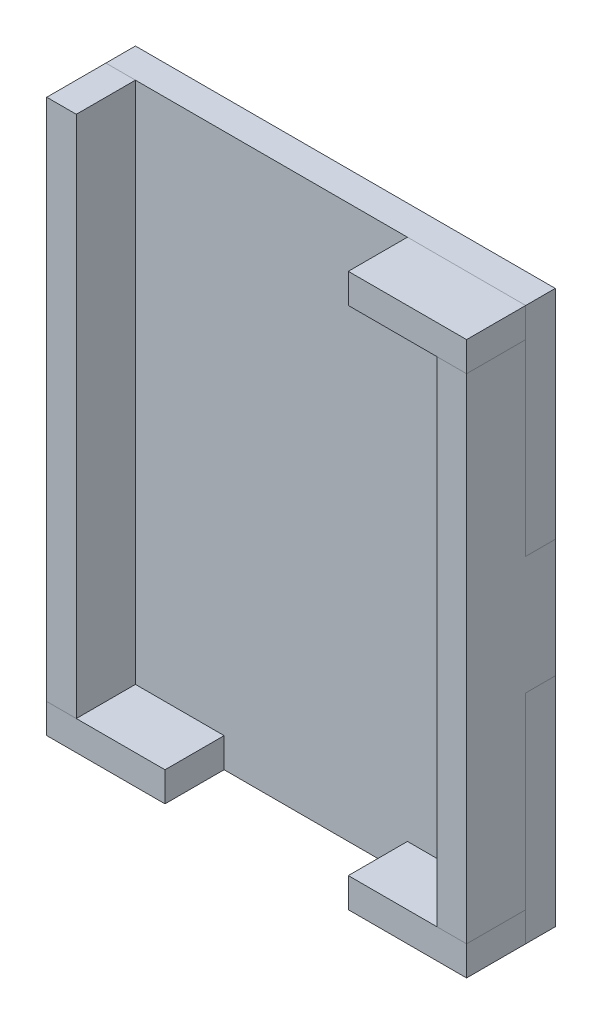
from build123d import *

# Parameters (mm, degrees)
BOSS_EXTRU_1_DEPTH   = 3.175
ESQUISSE2_W          = 25.4
ESQUISSE2_H          = 6.35
BOSS_EXTRU_2_DEPTH   = 12.7
ESQUISSE3_W          = 25.4
ESQUISSE3_H          = 6.35
BOSS_EXTRU_3_DEPTH   = 12.7
BOSS_EXTRU_3_2_DEPTH = 12.7
BOSS_EXTRU_4_DEPTH   = 6.35
BOSS_EXTRU_5_DEPTH   = 6.35


with BuildPart() as part:
    # Esquisse1 → Boss.-Extru.1 (new, symmetric)
    with BuildSketch(Plane.XY):
        Polygon((-45.085, 59.3725), (45.085, 59.3725), (45.085, 12.7), (38.735, 12.7), (38.735, -12.7), (45.085, -12.7), (45.085, -59.3725), (-45.085, -59.3725), (-45.085, -12.7), (-38.735, -12.7), (-38.735, 12.7), (-45.085, 12.7), align=None)
    extrude(amount=BOSS_EXTRU_1_DEPTH, both=True)


with BuildPart() as body_2:
    # Esquisse2 → Boss.-Extru.2 (new body)
    with BuildSketch(Plane.XY.offset(3.175)):
        with Locations((32.385, 56.1975)):
            Rectangle(ESQUISSE2_W, ESQUISSE2_H)
    extrude(amount=BOSS_EXTRU_2_DEPTH)


with BuildPart() as body_3:
    # Esquisse3 → Boss.-Extru.3 (new body)
    with BuildSketch(Plane.XY.offset(3.175)):
        with Locations((-32.385, -56.1975)):
            Rectangle(ESQUISSE3_W, ESQUISSE3_H)
    extrude(amount=BOSS_EXTRU_3_DEPTH)


with BuildPart() as body_4:
    # Esquisse3 → Boss.-Extru.3 2 (new body)
    with BuildSketch(Plane.XY.offset(3.175)):
        with Locations((32.385, -56.1975)):
            Rectangle(ESQUISSE3_W, ESQUISSE3_H)
    extrude(amount=BOSS_EXTRU_3_2_DEPTH)


with BuildPart() as body_5:
    # Esquisse5 → Boss.-Extru.4 (new body)
    with BuildSketch(Plane(origin=(38.735, 0, 0), x_dir=(0, 0, -1), z_dir=(1, 0, 0))):
        Polygon((3.175, 12.7), (-3.175, 12.7), (-3.175, 53.0225), (-15.875, 53.0225), (-15.875, -53.0225), (-3.175, -53.0225), (-3.175, -12.7), (3.175, -12.7), align=None)
    extrude(amount=BOSS_EXTRU_4_DEPTH)


with BuildPart() as body_6:
    # Esquisse6 → Boss.-Extru.5 (new body)
    with BuildSketch(Plane.ZY.offset(38.735)):
        Polygon((-3.175, 12.7), (3.175, 12.7), (3.175, 59.3725), (15.875, 59.3725), (15.875, -53.0225), (3.175, -53.0225), (3.175, -12.7), (-3.175, -12.7), align=None)
    extrude(amount=BOSS_EXTRU_5_DEPTH)


solid = Compound([part.part, body_2.part, body_3.part, body_4.part, body_5.part, body_6.part])
